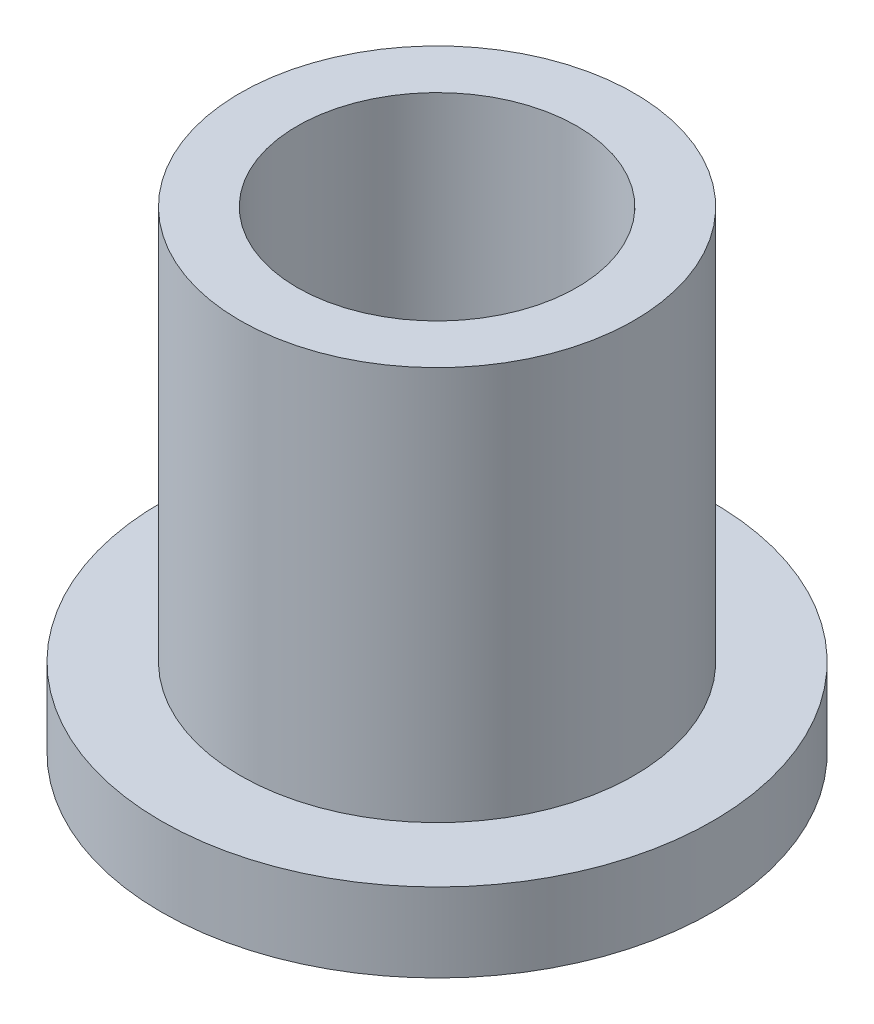
from build123d import *

# Parameters (mm, degrees)
SKETCH1_R           = 7
SKETCH1_R_2         = 3.55
BOSS_EXTRUDE1_DEPTH = 2
SKETCH2_R           = 5
SKETCH2_R_2         = 3.55
BOSS_EXTRUDE2_DEPTH = 10


with BuildPart() as part:
    # Sketch1 → Boss-Extrude1 (new body)
    with BuildSketch(Plane(origin=(0, 0, 0), x_dir=(1, 0, 0), z_dir=(0, 1, 0))):
        with Locations(Location((0, 0, 0), (0, 0, 270))):
            Circle(SKETCH1_R)
        with Locations(Location((0, 0, 0), (0, 0, 270))):
            Circle(SKETCH1_R_2, mode=Mode.SUBTRACT)
    extrude(amount=BOSS_EXTRUDE1_DEPTH)

    # Sketch2 → Boss-Extrude2 (add)
    with BuildSketch(Plane(origin=(0, 2, 0), x_dir=(1, 0, 0), z_dir=(0, 1, 0))):
        with Locations(Location((0, 0, 0), (0, 0, 270))):
            Circle(SKETCH2_R)
        with Locations(Location((0, 0, 0), (0, 0, 270))):
            Circle(SKETCH2_R_2, mode=Mode.SUBTRACT)
    extrude(amount=BOSS_EXTRUDE2_DEPTH)


solid = part.part
